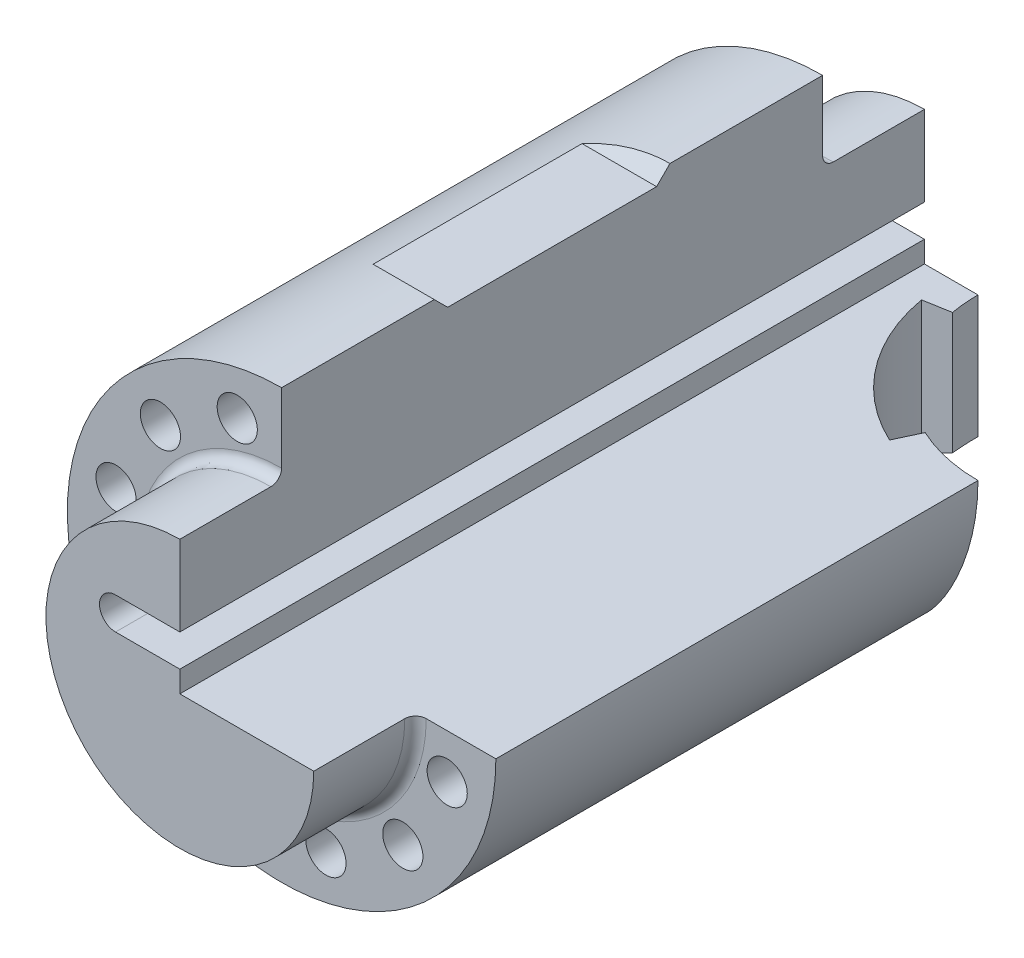
from build123d import *

# Parameters (mm, degrees)
SKETCH1_R           = 40
BOSS_EXTRUDE1_DEPTH = 139
SKETCH2_R           = 40
SKETCH2_R_2         = 25
CUT_EXTRUDE1_DEPTH  = 19
CUT_EXTRUDE2_START  = -19
SKETCH3_R           = 40
SKETCH3_R_2         = 25
CUT_EXTRUDE2_DEPTH  = 19
FILLET1_R           = 2
CUT_EXTRUDE7_DEPTH  = 151.069983674
CUT_EXTRUDE8_DEPTH  = 151.069983674
CUT_EXTRUDE9_DEPTH  = 151.069983674
SKETCH8_R           = 3.75
CUT_EXTRUDE10_DEPTH = 151.069983674
CIRPATTERN1_COUNT   = 12
CUT_EXTRUDE14_DEPTH = 151.069983674


with BuildPart() as part:
    # Sketch1 → Boss-Extrude1 (new body)
    with BuildSketch(Plane.XY):
        Circle(SKETCH1_R)
    extrude(amount=-BOSS_EXTRUDE1_DEPTH)

    # Sketch2 → Cut-Extrude1 (cut)
    with BuildSketch(Plane.XY):
        Circle(SKETCH2_R)
        Circle(SKETCH2_R_2, mode=Mode.SUBTRACT)
    extrude(amount=-CUT_EXTRUDE1_DEPTH, mode=Mode.SUBTRACT)

    # Sketch3 → Cut-Extrude2 (cut)
    with BuildSketch(Plane(origin=(0, 0, -139), x_dir=(-1, 0, 0), z_dir=(0, 0, -1)).offset(CUT_EXTRUDE2_START)):
        with Locations(Location((0, 0, 0), (0, 0, 180))):
            Circle(SKETCH3_R)
        with Locations(Location((0, 0, 0), (0, 0, 180))):
            Circle(SKETCH3_R_2, mode=Mode.SUBTRACT)
    extrude(amount=CUT_EXTRUDE2_DEPTH, mode=Mode.SUBTRACT)

    # Fillet1
    fillet1_edges = [part.edges().sort_by_distance(p)[0] for p in [
        (-25, 0, -120),
        (-25, 0, -19),
    ]]
    fillet(fillet1_edges, radius=FILLET1_R)

    # Sketch5 → Cut-Extrude7 (cut, through all)
    with BuildSketch(Plane.XY):
        Polygon((0, 40), (0, 0), (40, 0), align=None)
    extrude(amount=-CUT_EXTRUDE7_DEPTH, mode=Mode.SUBTRACT)


with BuildPart() as body_2:
    # of the pieces the cut leaves, the one that is kept (cut_extrude7_keep)
    add(part.part.solids().sort_by_distance((27, 0, -120))[0])

    # Sketch6 → Cut-Extrude8 (cut, through all)
    with BuildSketch(Plane.XY):
        with BuildLine():
            Line((12, 4), (-12, 4))
            ThreePointArc((-12, 4), (-15, 7), (-12, 10))
            Line((-12, 10), (12, 10))
            ThreePointArc((12, 10), (15, 7), (12, 4))
        make_face()
    extrude(amount=-CUT_EXTRUDE8_DEPTH, mode=Mode.SUBTRACT)

    # Sketch7 → Cut-Extrude9 (cut, through all)
    with BuildSketch(Plane(origin=(0, 0, 0), x_dir=(0, 0, -1), z_dir=(1, 0, 0))):
        Polygon((91.5, 40), (47.5, 40), (50, 37.5), (89, 37.5), align=None)
    extrude(amount=-CUT_EXTRUDE9_DEPTH, mode=Mode.SUBTRACT)

    # Sketch8 → Cut-Extrude10 (cut, through all)
    with BuildSketch(Plane.XY):
        with Locations((-8.282209443, 30.909626441)):
            Circle(SKETCH8_R)
    cut_extrude10 = extrude(amount=-CUT_EXTRUDE10_DEPTH, mode=Mode.SUBTRACT)

    # CirPattern1: Cut-Extrude10 ×12 about axis
    cirpattern1_axis = Axis((0, 0, -19), (0, 0, 1))
    for i in range(1, CIRPATTERN1_COUNT):
        add(cut_extrude10.rotate(cirpattern1_axis, i * 360 / CIRPATTERN1_COUNT), mode=Mode.SUBTRACT)

    # Sketch9 → Cut-Extrude14 (cut, through all)
    with BuildSketch(Plane(origin=(0, 0, 0), x_dir=(1, 0, 0), z_dir=(0, 1, 0))):
        with BuildLine():
            Line((40, 139), (10, 139))
            ThreePointArc((10, 139), (10.114159057, 136.385327718), (10.45576741, 133.79055467))
            Line((10.45576741, 133.79055467), (40, 139))
        make_face()
        with BuildLine():
            Line((40, 109), (40, 139))
            Line((40, 139), (27.321452148, 111.810766389))
            ThreePointArc((27.321452148, 111.810766389), (33.506811582, 109.711119786), (40, 109))
        make_face()
        with BuildLine():
            Line((27.321452148, 111.810766389), (40, 139))
            Line((40, 139), (10.45576741, 133.79055467))
            ThreePointArc((10.45576741, 133.79055467), (16.199399791, 120.73715713), (27.321452148, 111.810766389))
        make_face()
        with BuildLine():
            ThreePointArc((27.321452148, 111.810766389), (16.199399791, 120.73715713), (10.45576741, 133.79055467))
            Line((10.45576741, 133.79055467), (5.531728645, 132.922313782))
            ThreePointArc((5.531728645, 132.922313782), (12.23263309, 117.693349985), (25.208360839, 107.279227454))
            Line((25.208360839, 107.279227454), (27.321452148, 111.810766389))
        make_face()
    extrude(amount=-CUT_EXTRUDE14_DEPTH, mode=Mode.SUBTRACT)


solid = body_2.part
